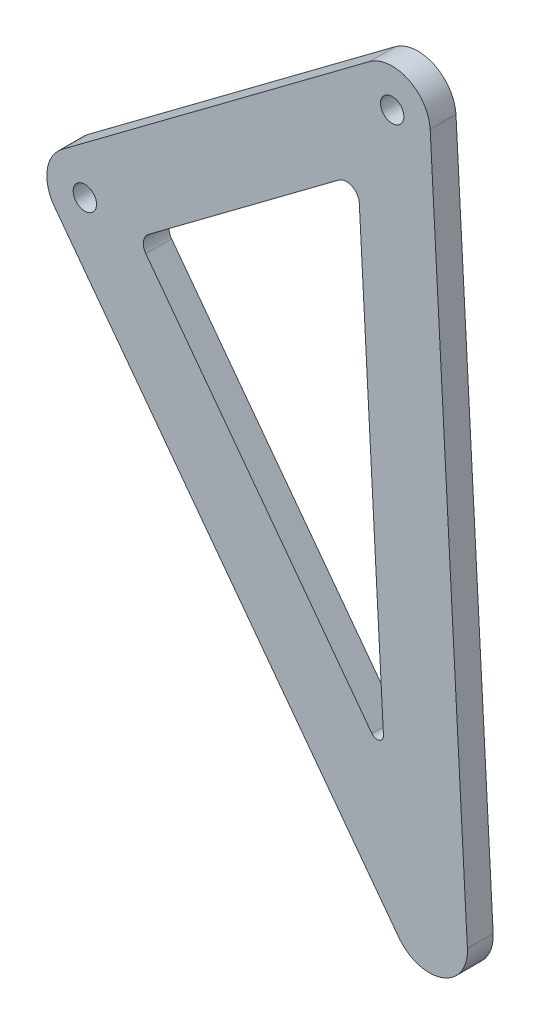
from build123d import *

# Parameters (mm, degrees)
BOSS_EXTRUDE1_DEPTH = 5.08


with BuildPart() as part:
    # Sketch1 → Boss-Extrude1 (new body)
    with BuildSketch(Plane.XY):
        with BuildLine():
            Line((149.742446498, 0.425166718), (142.412299482, 136.517741625))
            ThreePointArc((142.412299482, 136.517741625), (141.974063379, 138.670668966), (140.930746882, 140.604224682))
            ThreePointArc((140.930746882, 140.604224682), (135.996353851, 143.53718437), (130.433295393, 142.121957281))
            Line((130.433295393, 142.121957281), (69.876767595, 96.864174071))
            ThreePointArc((69.876767595, 96.864174071), (66.943807907, 91.92978104), (68.359034997, 86.366722582))
            Line((68.359034997, 86.366722582), (136.245709811, -4.468069115))
            ThreePointArc((136.245709811, -4.468069115), (139.075136314, -6.771534614), (142.656678242, -7.467354313))
            ThreePointArc((142.656678242, -7.467354313), (144.809605584, -7.02911821), (146.7431613, -5.985801713))
            ThreePointArc((146.7431613, -5.985801713), (149.046626799, -3.15637521), (149.742446498, 0.425166718))
        make_face()
        with BuildLine():
            ThreePointArc((72.989736811, 92.698910254), (76.208955267, 92.233472258), (75.74351727, 89.014253801))
            ThreePointArc((75.74351727, 89.014253801), (72.524298814, 89.479691798), (72.989736811, 92.698910254))
        make_face(mode=Mode.SUBTRACT)
        with BuildLine():
            Line((128.442984245, 116.978229985), (133.206299189, 28.541832403))
            ThreePointArc((133.206299189, 28.541832403), (132.371004795, 27.279573488), (130.920851777, 27.713244469))
            Line((130.920851777, 27.713244469), (86.384644261, 87.304278258))
            ThreePointArc((86.384644261, 87.304278258), (85.90535402, 89.188300722), (86.898649701, 90.859415162))
            Line((86.898649701, 90.859415162), (124.386094861, 118.87619102))
            ThreePointArc((124.386094861, 118.87619102), (126.982999322, 119.142292563), (128.442984245, 116.978229985))
        make_face(mode=Mode.SUBTRACT)
        with BuildLine():
            ThreePointArc((135.046856931, 133.817694213), (132.626483815, 135.990663145), (134.799452746, 138.411036261))
            ThreePointArc((134.799452746, 138.411036261), (137.219825863, 136.238067329), (135.046856931, 133.817694213))
        make_face(mode=Mode.SUBTRACT)
    extrude(amount=BOSS_EXTRUDE1_DEPTH)


solid = part.part
